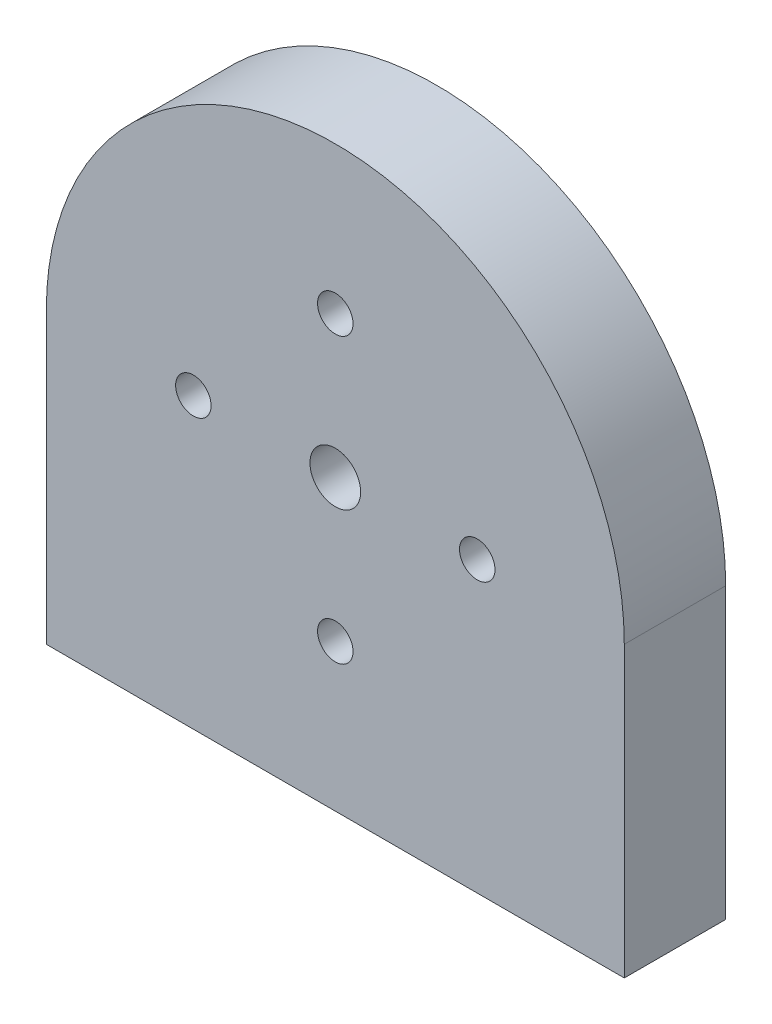
from build123d import *

# Parameters (mm, degrees)
SKETCH_1_R      = 1.75
SKETCH_1_R_2    = 2.5
EXTRUDE_1_DEPTH = 10


with BuildPart() as part:
    # Эскиз1 → Бобышка-Вытянуть1 (new body)
    with BuildSketch(Plane.XY):
        with BuildLine():
            Line((-28.5, 0), (-28.5, -28.5))
            Line((-28.5, -28.5), (28.5, -28.5))
            Line((28.5, -28.5), (28.5, 0))
            ThreePointArc((28.5, 0), (0, 28.5), (-28.5, 0))
        make_face()
        with Locations((0, 14)):
            Circle(SKETCH_1_R, mode=Mode.SUBTRACT)
        with Locations((14, 0)):
            Circle(SKETCH_1_R, mode=Mode.SUBTRACT)
        with Locations((0, -14)):
            Circle(SKETCH_1_R, mode=Mode.SUBTRACT)
        with Locations((-14, 0)):
            Circle(SKETCH_1_R, mode=Mode.SUBTRACT)
        Circle(SKETCH_1_R_2, mode=Mode.SUBTRACT)
    extrude(amount=EXTRUDE_1_DEPTH)


solid = part.part
